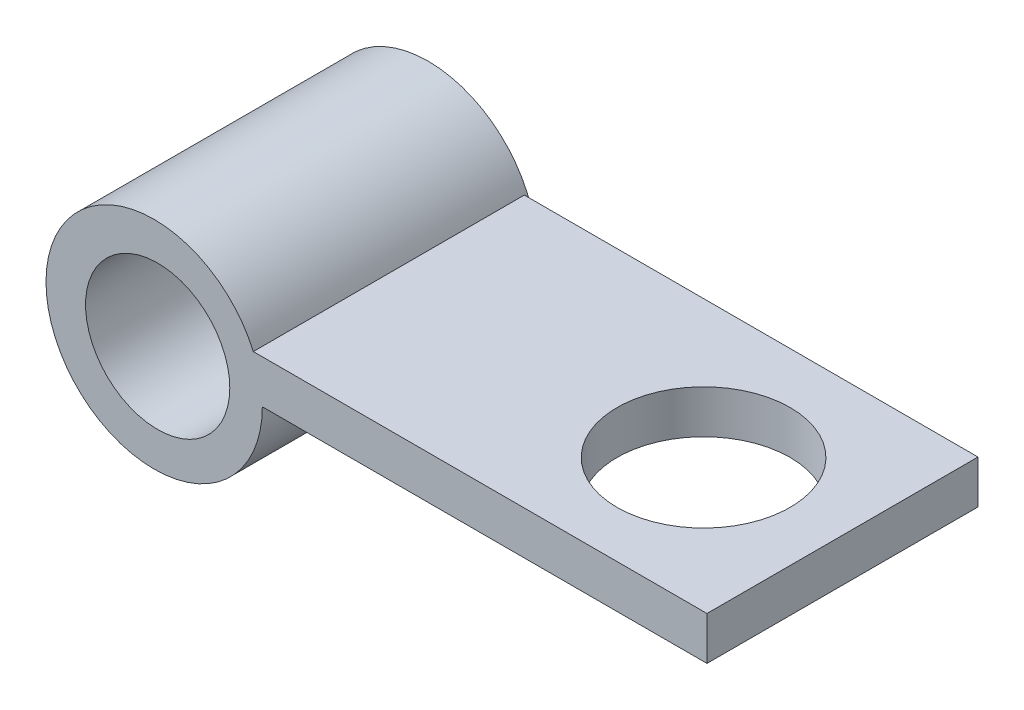
from build123d import *

# Parameters (mm, degrees)
F_3DSKETCH1_R       = 6
BOSS_EXTRUDE3_DEPTH = 3
SKETCH3_R           = 7.5
SKETCH3_R_2         = 5
BOSS_EXTRUDE5_DEPTH = 19


with BuildPart() as part:
    # 3DSketch1 → Boss-Extrude3 (new body)
    with BuildSketch(Plane(origin=(-1.906972696, 0, 4.753867784), x_dir=(0.8585635359116023, 0, 0.5127071823204421), z_dir=(0, -1, 0))):
        Polygon((0, 0), (9.634447543, 16.133546855), (36.65118441, 0), (27.016736867, -16.133546855), align=None)
        with Locations(Location((23.762707279, -3.079667236, 0), (0, 0, 59.155677363))):
            Circle(F_3DSKETCH1_R, mode=Mode.SUBTRACT)
    extrude(amount=-BOSS_EXTRUDE3_DEPTH)

    # Sketch3 → Boss-Extrude5 (add)
    with BuildSketch(Plane(origin=(-8.525652269, 0, 23.545193271), x_dir=(1, 0, 0), z_dir=(0, 0, 1))):
        with Locations((-0.242866193, 0)):
            Circle(SKETCH3_R)
        Circle(SKETCH3_R_2, mode=Mode.SUBTRACT)
    extrude(amount=-BOSS_EXTRUDE5_DEPTH)


solid = part.part
